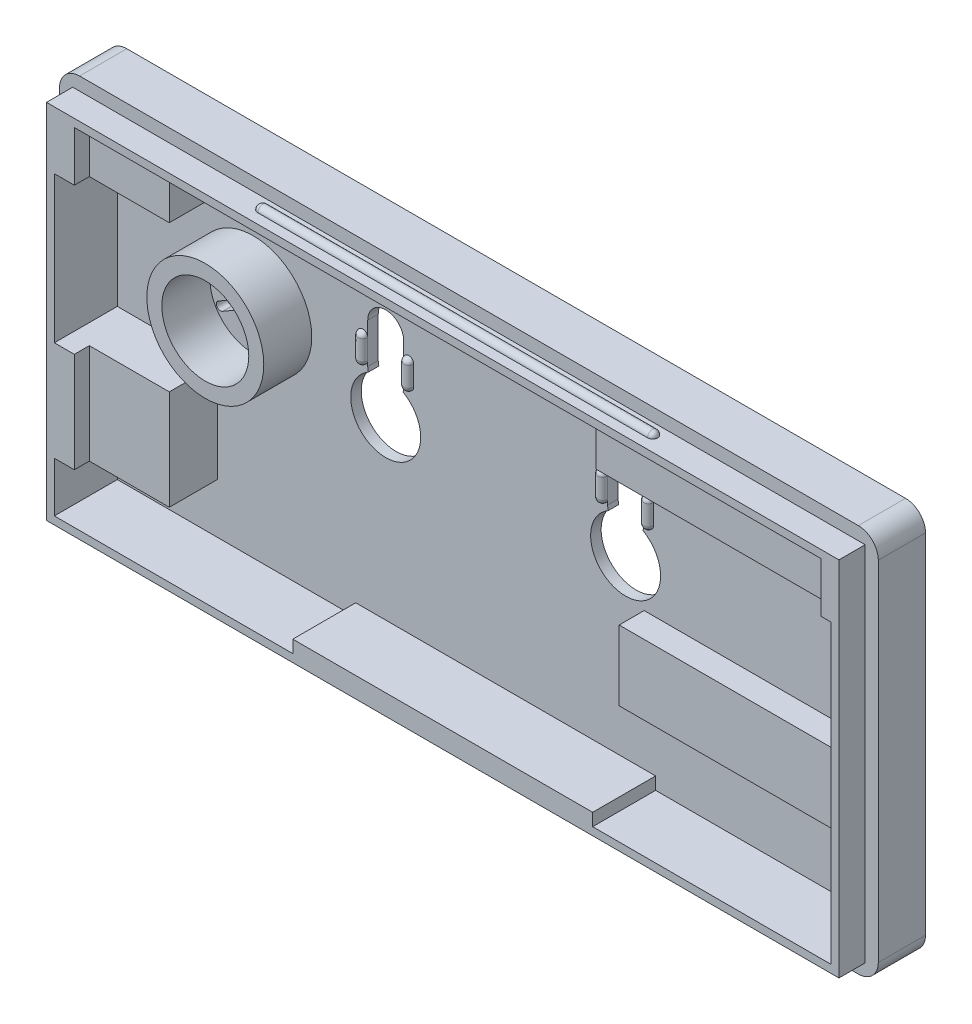
from build123d import *

# Parameters (mm, degrees)
SKIZZE1_W                       = 78
SKIZZE1_H                       = 37
AUFSATZ_LINEAR_AUSTRAGEN1_DEPTH = 4.5
SKIZZE1_3_W                     = 75.5
SKIZZE1_3_H                     = 34.5
AUFSATZ_LINEAR_AUSTRAGEN2_DEPTH = 7
SKIZZE1_4_W                     = 74
SKIZZE1_4_H                     = 33
SCHNITT_LINEAR_AUSTRAGEN1_DEPTH = 7
SKIZZE1_5_W                     = 78
SKIZZE1_5_H                     = 37
SKIZZE1_5_W_2                   = 75.5
SKIZZE1_5_H_2                   = 34.5
SKIZZE1_5_W_3                   = 74
SKIZZE1_5_H_3                   = 33
SKIZZE1_5_R                     = 5.85
SKIZZE1_5_R_2                   = 4.35
AUFSATZ_LINEAR_AUSTRAGEN3_DEPTH = 1
SKIZZE1_6_R                     = 5.85
SKIZZE1_6_R_2                   = 4.35
AUFSATZ_LINEAR_AUSTRAGEN4_DEPTH = 1
SKALIEREN1_SCALE                = 1.05
SKIZZE4_R                       = 3.5
SCHNITT_LINEAR_AUSTRAGEN2_DEPTH = 1.05
SKIZZE5_W                       = 6.3
SKIZZE5_H                       = 10
SKIZZE5_H_2                     = 5
AUFSATZ_LINEAR_AUSTRAGEN5_DEPTH = 10
SKIZZE6_W                       = 2.5
SKIZZE6_H                       = 7
SKIZZE6_W_2                     = 6.3
SKIZZE6_H_2                     = 5
AUFSATZ_LINEAR_AUSTRAGEN6_DEPTH = 25
SKIZZE10_W                      = 8
SKIZZE10_H                      = 5
SKIZZE10_H_2                    = 10
SKIZZE10_W_2                    = 24
SCHNITT_LINEAR_AUSTRAGEN4_DEPTH = 1.5
SKIZZE1_7_R                     = 5.85
SKIZZE1_7_R_2                   = 4.35
AUFSATZ_LINEAR_AUSTRAGEN8_DEPTH = 5.766894584
SCHNITT_LINEAR_AUSTRAGEN3_DEPTH = 1.05
ROTATION1_ANGLE                 = 180
SPIEGELN3_COPY_1_ANGLE          = 180
SPIEGELN3_COPY_2_ANGLE          = 180
SPIEGELN4_COPY_1_ANGLE          = 180
SPIEGELN4_COPY_2_ANGLE          = 180
SPIEGELN4_COPY_3_ANGLE          = 180
SPIEGELN4_COPY_4_ANGLE          = 180
SPIEGELN4_COPY_5_ANGLE          = 180
VERRUNDUNG1_R                   = 2
SKIZZE13_W                      = 30
SKIZZE13_H                      = 1.25
AUFSATZ_LINEAR_AUSTRAGEN9_DEPTH = 6.3


with BuildPart() as part:
    # Skizze1 → Aufsatz-Linear austragen1 (new body)
    with BuildSketch(Plane.XY):
        with Locations((37, 16.5)):
            Rectangle(SKIZZE1_W, SKIZZE1_H)
    extrude(amount=AUFSATZ_LINEAR_AUSTRAGEN1_DEPTH)

    # Skizze1<3> → Aufsatz-Linear austragen2 (add)
    with BuildSketch(Plane.XY):
        with Locations((37, 16.5)):
            Rectangle(SKIZZE1_3_W, SKIZZE1_3_H)
    extrude(amount=AUFSATZ_LINEAR_AUSTRAGEN2_DEPTH)

    # Skizze1<4> → Schnitt-Linear austragen1 (cut)
    with BuildSketch(Plane.XY):
        with Locations((37, 16.5)):
            Rectangle(SKIZZE1_4_W, SKIZZE1_4_H)
    extrude(amount=SCHNITT_LINEAR_AUSTRAGEN1_DEPTH, mode=Mode.SUBTRACT)

    # Skizze1<5> → Aufsatz-Linear austragen3 (add)
    # profile 1 of 3: a face of its own
    with BuildSketch(Plane.XY):
        with Locations((37, 16.5)):
            Rectangle(SKIZZE1_5_W, SKIZZE1_5_H)
        with Locations((37, 16.5)):
            Rectangle(SKIZZE1_5_W_2, SKIZZE1_5_H_2, mode=Mode.SUBTRACT)
    # profile 2 of 3: a face of its own
    with BuildSketch(Plane.XY):
        with Locations((37, 16.5)):
            Rectangle(SKIZZE1_5_W_3, SKIZZE1_5_H_3)
        with Locations((11.75, 21.25)):
            Circle(SKIZZE1_5_R, mode=Mode.SUBTRACT)
    # profile 3 of 3: a face of its own
    with BuildSketch(Plane.XY):
        with Locations((11.75, 21.25)):
            Circle(SKIZZE1_5_R_2)
    extrude(amount=AUFSATZ_LINEAR_AUSTRAGEN3_DEPTH)


with BuildPart() as aufsatz_linear_austragen3_kept_piece:
    # of the separate pieces the step leaves, the one the design keeps (aufsatz_linear_austragen3_pieces_kept)
    add(part.part.solids().sort_by_distance((-2, 35, 0))[0])

    # Skizze1<6> → Aufsatz-Linear austragen4 (add)
    # profile 1 of 2: a face of its own
    with BuildSketch(Plane.XY):
        with Locations((11.75, 21.25)):
            Circle(SKIZZE1_6_R)
        with Locations((11.75, 21.25)):
            Circle(SKIZZE1_6_R_2, mode=Mode.SUBTRACT)
    # profile 2 of 2: a face of its own
    with BuildSketch(Plane.XY):
        with Locations((11.75, 21.25)):
            Circle(SKIZZE1_6_R_2)
    extrude(amount=AUFSATZ_LINEAR_AUSTRAGEN4_DEPTH)


with BuildPart() as aufsatz_linear_austragen3_kept_piece_1:
    # Skalieren1: scaled about (37, 16.5, 1.662108317)
    add(aufsatz_linear_austragen3_kept_piece.part.scale(SKALIEREN1_SCALE).moved(Location((-1.85, -0.825, -0.083105416))))

    # Skizze4 → Schnitt-Linear austragen2 (cut)
    with BuildSketch(Plane(origin=(0, 0, -0.083105416), x_dir=(-1, 0, 0), z_dir=(0, 0, -1))):
        with Locations((-49, 18)):
            Circle(SKIZZE4_R)
        with BuildLine():
            Line((-50.8, 21.5), (-50.8, 25.5))
            ThreePointArc((-50.8, 25.5), (-49, 27.3), (-47.2, 25.5))
            Line((-47.2, 25.5), (-47.2, 21.5))
            ThreePointArc((-47.2, 21.5), (-49, 19.7), (-50.8, 21.5))
        make_face()
    schnitt_linear_austragen2 = extrude(amount=-SCHNITT_LINEAR_AUSTRAGEN2_DEPTH, mode=Mode.SUBTRACT)

    # Spiegeln1: Schnitt-Linear austragen2 across plane
    add(schnitt_linear_austragen2.mirror(Plane(origin=(37, 0, 0), x_dir=(0, 0, 1), z_dir=(1, 0, 0))), mode=Mode.SUBTRACT)

    # Skizze5 → Aufsatz-Linear austragen5 (add)
    with BuildSketch(Plane(origin=(-1.85, 0, 0), x_dir=(0, 0, -1), z_dir=(1, 0, 0))):
        with Locations((-4.116894584, 9.175)):
            Rectangle(SKIZZE5_W, SKIZZE5_H)
        with Locations((-4.116894584, 31.325)):
            Rectangle(SKIZZE5_W, SKIZZE5_H_2)
    extrude(amount=AUFSATZ_LINEAR_AUSTRAGEN5_DEPTH)

    # Skizze6 → Aufsatz-Linear austragen6 (add)
    with BuildSketch(Plane.ZY.offset(-75.85)):
        with Locations((2.216894584, 10.675)):
            Rectangle(SKIZZE6_W, SKIZZE6_H)
        with Locations((4.116894584, 31.325)):
            Rectangle(SKIZZE6_W_2, SKIZZE6_H_2)
    extrude(amount=AUFSATZ_LINEAR_AUSTRAGEN6_DEPTH)

    # Skizze10 → Schnitt-Linear austragen4 (cut)
    with BuildSketch(Plane.XY.offset(7.266894584)):
        with Locations((4.15, 31.325)):
            Rectangle(SKIZZE10_W, SKIZZE10_H)
        with Locations((4.15, 9.175)):
            Rectangle(SKIZZE10_W, SKIZZE10_H_2)
        with Locations((62.85, 31.325)):
            Rectangle(SKIZZE10_W_2, SKIZZE10_H)
    extrude(amount=-SCHNITT_LINEAR_AUSTRAGEN4_DEPTH, mode=Mode.SUBTRACT)

    # Skizze1<7> → Aufsatz-Linear austragen8 (add)
    with BuildSketch(Plane.XY):
        with Locations((11.75, 21.25)):
            Circle(SKIZZE1_7_R)
        with Locations((11.75, 21.25)):
            Circle(SKIZZE1_7_R_2, mode=Mode.SUBTRACT)
    extrude(amount=AUFSATZ_LINEAR_AUSTRAGEN8_DEPTH)

    # Skizze8 → Schnitt-Linear austragen3 (cut)
    with BuildSketch(Plane.XY.offset(0.966894584)):
        with BuildLine():
            Line((11.3499, 25.049999998), (11.3499, 22.549999998))
            ThreePointArc((11.3499, 22.549999998), (11.7499, 22.149999998), (12.1499, 22.549999998))
            Line((12.1499, 22.549999998), (12.1499, 25.049999998))
            ThreePointArc((12.1499, 25.049999998), (11.7499, 25.449999998), (11.3499, 25.049999998))
        make_face()
        with BuildLine():
            Line((8.259053467, 22.803503235), (10.424116977, 21.553503235))
            ThreePointArc((10.424116977, 21.553503235), (10.970527138, 21.699913396), (10.824116977, 22.246323558))
            Line((10.824116977, 22.246323558), (8.659053467, 23.496323558))
            ThreePointArc((8.659053467, 23.496323558), (8.112643306, 23.349913396), (8.259053467, 22.803503235))
        make_face()
        with BuildLine():
            Line((14.840846533, 23.496496763), (12.675783023, 22.246496763))
            ThreePointArc((12.675783023, 22.246496763), (12.529372862, 21.700086602), (13.075783023, 21.55367644))
            Line((13.075783023, 21.55367644), (15.240846533, 22.80367644))
            ThreePointArc((15.240846533, 22.80367644), (15.387256694, 23.350086602), (14.840846533, 23.496496763))
        make_face()
        with BuildLine():
            Line((15.240946533, 19.696496765), (13.075883023, 20.946496765))
            ThreePointArc((13.075883023, 20.946496765), (12.529472862, 20.800086604), (12.675883023, 20.253676442))
            Line((12.675883023, 20.253676442), (14.840946533, 19.003676442))
            ThreePointArc((14.840946533, 19.003676442), (15.387356694, 19.150086604), (15.240946533, 19.696496765))
        make_face()
        with BuildLine():
            Line((12.1501, 17.450000002), (12.1501, 19.950000002))
            ThreePointArc((12.1501, 19.950000002), (11.7501, 20.350000002), (11.3501, 19.950000002))
            Line((11.3501, 19.950000002), (11.3501, 17.450000002))
            ThreePointArc((11.3501, 17.450000002), (11.7501, 17.050000002), (12.1501, 17.450000002))
        make_face()
        with BuildLine():
            Line((8.659153467, 19.003503237), (10.824216977, 20.253503237))
            ThreePointArc((10.824216977, 20.253503237), (10.970627138, 20.799913398), (10.424216977, 20.94632356))
            Line((10.424216977, 20.94632356), (8.259153467, 19.69632356))
            ThreePointArc((8.259153467, 19.69632356), (8.112743306, 19.149913398), (8.659153467, 19.003503237))
        make_face()
    extrude(amount=-SCHNITT_LINEAR_AUSTRAGEN3_DEPTH, mode=Mode.SUBTRACT)

    # Skizze9 → Rotation1 (revolve)
    with BuildSketch(Plane.XZ.offset(1.6125)):
        with BuildLine():
            Line((17, 5.766894584), (37, 5.766894584))
            Line((37, 5.766894584), (37, 5.266894584))
            Line((37, 5.266894584), (17.5, 5.266894584))
            ThreePointArc((17.5, 5.266894584), (17.146446609, 5.413341194), (17, 5.766894584))
        make_face()
    rotation1 = revolve(axis=Axis((17, -1.6125, 5.766894584), (1, 0, 0)), revolution_arc=ROTATION1_ANGLE)

    # Spiegeln2: Rotation1 across plane
    add(rotation1.mirror(Plane(origin=(-2.6375, -1.6125, 7.266894584), x_dir=(0, 0, 1), z_dir=(0, 1, 0))))

    # Spiegeln3 copy 1 sketch → Spiegeln3 copy 1 (revolve)
    with BuildSketch(Plane(origin=(74, -1.6125, 0), x_dir=(-1, 0, 0), z_dir=(0, 1, 0))):
        with BuildLine():
            Line((17, 5.766894584), (37, 5.766894584))
            Line((37, 5.766894584), (37, 5.266894584))
            Line((37, 5.266894584), (17.5, 5.266894584))
            ThreePointArc((17.5, 5.266894584), (17.146446609, 5.413341194), (17, 5.766894584))
        make_face()
    revolve(axis=Axis((57, -1.6125, 5.766894584), (-1, 0, 0)), revolution_arc=SPIEGELN3_COPY_1_ANGLE)

    # Spiegeln3 copy 2 sketch → Spiegeln3 copy 2 (revolve)
    with BuildSketch(Plane(origin=(74, -1.6125, 0), x_dir=(-1, 0, 0), z_dir=(0, -1, 0))):
        with BuildLine():
            Line((17, -5.766894584), (37, -5.766894584))
            Line((37, -5.766894584), (37, -5.266894584))
            Line((37, -5.266894584), (17.5, -5.266894584))
            ThreePointArc((17.5, -5.266894584), (17.146446609, -5.413341194), (17, -5.766894584))
        make_face()
    revolve(axis=Axis((57, -1.6125, 5.766894584), (1, 0, 0)), revolution_arc=SPIEGELN3_COPY_2_ANGLE)

    # Spiegeln4 copy 1 sketch → Spiegeln4 copy 1 (revolve)
    with BuildSketch(Plane.XZ.offset(-34.6125)):
        with BuildLine():
            Line((17, 5.766894584), (37, 5.766894584))
            Line((37, 5.766894584), (37, 5.266894584))
            Line((37, 5.266894584), (17.5, 5.266894584))
            ThreePointArc((17.5, 5.266894584), (17.146446609, 5.413341194), (17, 5.766894584))
        make_face()
    revolve(axis=Axis((17, 34.6125, 5.766894584), (1, 0, 0)), revolution_arc=SPIEGELN4_COPY_1_ANGLE)

    # Spiegeln4 copy 2 sketch → Spiegeln4 copy 2 (revolve)
    with BuildSketch(Plane(origin=(0, 34.6125, 0), x_dir=(1, 0, 0), z_dir=(0, 1, 0))):
        with BuildLine():
            Line((17, -5.766894584), (37, -5.766894584))
            Line((37, -5.766894584), (37, -5.266894584))
            Line((37, -5.266894584), (17.5, -5.266894584))
            ThreePointArc((17.5, -5.266894584), (17.146446609, -5.413341194), (17, -5.766894584))
        make_face()
    revolve(axis=Axis((17, 34.6125, 5.766894584), (-1, 0, 0)), revolution_arc=SPIEGELN4_COPY_2_ANGLE)

    # Spiegeln4 copy 3 sketch → Spiegeln4 copy 3 (revolve)
    with BuildSketch(Plane(origin=(74, 34.6125, 0), x_dir=(-1, 0, 0), z_dir=(0, -1, 0))):
        with BuildLine():
            Line((17, -5.766894584), (37, -5.766894584))
            Line((37, -5.766894584), (37, -5.266894584))
            Line((37, -5.266894584), (17.5, -5.266894584))
            ThreePointArc((17.5, -5.266894584), (17.146446609, -5.413341194), (17, -5.766894584))
        make_face()
    revolve(axis=Axis((57, 34.6125, 5.766894584), (1, 0, 0)), revolution_arc=SPIEGELN4_COPY_3_ANGLE)

    # Spiegeln4 copy 4 sketch → Spiegeln4 copy 4 (revolve)
    with BuildSketch(Plane(origin=(74, 34.6125, 0), x_dir=(-1, 0, 0), z_dir=(0, 1, 0))):
        with BuildLine():
            Line((17, 5.766894584), (37, 5.766894584))
            Line((37, 5.766894584), (37, 5.266894584))
            Line((37, 5.266894584), (17.5, 5.266894584))
            ThreePointArc((17.5, 5.266894584), (17.146446609, 5.413341194), (17, 5.766894584))
        make_face()
    revolve(axis=Axis((57, 34.6125, 5.766894584), (-1, 0, 0)), revolution_arc=SPIEGELN4_COPY_4_ANGLE)

    # Spiegeln4 copy 5 sketch → Spiegeln4 copy 5 (revolve)
    with BuildSketch(Plane(origin=(0, 34.6125, 0), x_dir=(1, 0, 0), z_dir=(0, 1, 0))):
        with BuildLine():
            Line((17, -5.766894584), (37, -5.766894584))
            Line((37, -5.766894584), (37, -5.266894584))
            Line((37, -5.266894584), (17.5, -5.266894584))
            ThreePointArc((17.5, -5.266894584), (17.146446609, -5.413341194), (17, -5.766894584))
        make_face()
    revolve(axis=Axis((17, 34.6125, 5.766894584), (-1, 0, 0)), revolution_arc=SPIEGELN4_COPY_5_ANGLE)

    # Verrundung1
    verrundung1_edges = [aufsatz_linear_austragen3_kept_piece_1.edges().sort_by_distance(p)[0] for p in [
        (-3.95, 35.925, 2.279394584),
        (77.95, 35.925, 2.279394584),
        (77.95, -2.925, 2.279394584),
        (-3.95, -2.925, 2.279394584),
    ]]
    fillet(verrundung1_edges, radius=VERRUNDUNG1_R)

    # Skizze12 → Rotation2 (revolve)
    with BuildSketch(Plane.XY.offset(0.966894584)):
        with BuildLine():
            Line((22.7, 24.5), (22.7, 21.5))
            ThreePointArc((22.7, 21.5), (23.053553391, 21.646446609), (23.2, 22))
            Line((23.2, 22), (23.2, 24))
            ThreePointArc((23.2, 24), (23.053553391, 24.353553391), (22.7, 24.5))
        make_face()
    rotation2 = revolve(axis=Axis((22.7, 24.5, 0.966894584), (0, -1, 0)))

    # Spiegeln5: Rotation2 across plane
    add(rotation2.mirror(Plane(origin=(25, 0, 0), x_dir=(0, 0, 1), z_dir=(1, 0, 0))))

    # Spiegeln6: Rotation2 across plane
    add(rotation2.mirror(Plane(origin=(37, 0, 0), x_dir=(0, 0, 1), z_dir=(1, 0, 0))))

    # Spiegeln6 copy 1 sketch → Spiegeln6 copy 1 (revolve)
    with BuildSketch(Plane(origin=(24, 0, 0.966894584), x_dir=(1, 0, 0), z_dir=(0, 0, 1))):
        with BuildLine():
            Line((22.7, 24.5), (22.7, 21.5))
            ThreePointArc((22.7, 21.5), (23.053553391, 21.646446609), (23.2, 22))
            Line((23.2, 22), (23.2, 24))
            ThreePointArc((23.2, 24), (23.053553391, 24.353553391), (22.7, 24.5))
        make_face()
    revolve(axis=Axis((46.7, 24.5, 0.966894584), (0, -1, 0)))

    # Skizze13 → Aufsatz-Linear austragen9 (add)
    with BuildSketch(Plane.XY.offset(0.966894584)):
        with Locations((37, -0.2)):
            Rectangle(SKIZZE13_W, SKIZZE13_H)
    extrude(amount=AUFSATZ_LINEAR_AUSTRAGEN9_DEPTH)


solid = aufsatz_linear_austragen3_kept_piece_1.part
